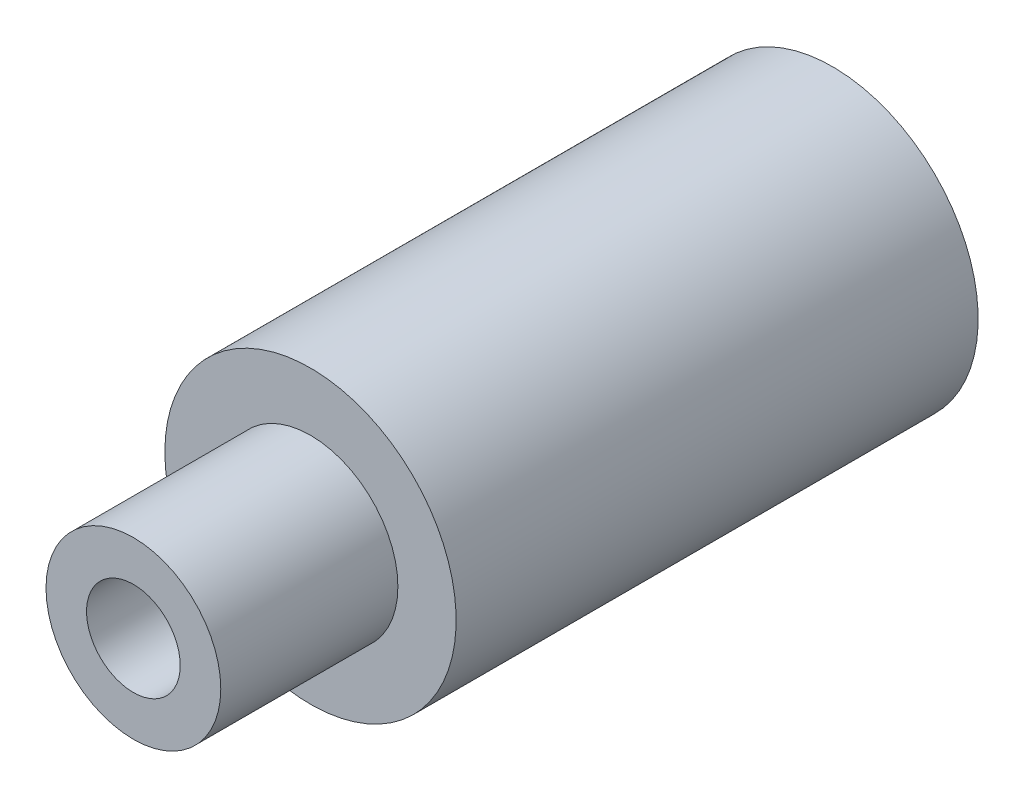
from build123d import *

# Parameters (mm, degrees)
SKETCH2_R                   = 7.9375
CYLINDER_BASE_DEPTH         = 38.1
TRIM_1_DEPTH                = 40.71923731
TRIM_1_DEPTH_BACK           = 9.652
SKETCH3_OUTSIDE_W           = 26.72
SKETCH3_OUTSIDE_H           = 26.72
SKETCH3_OUTSIDE_R           = 4.7625
F_1_4_20_TAPPED_HOLE1_D     = 5.1054
F_1_4_20_TAPPED_HOLE1_DEPTH = 17.516183098
F_1_4_20_TAPPED_HOLE1_TIP   = 1.533816902
F_1_4_20_TAPPED_HOLE9_D     = 5.1054
F_1_4_20_TAPPED_HOLE9_DEPTH = 12.436183098
F_1_4_20_TAPPED_HOLE9_TIP   = 1.533816902
SKETCH20_R                  = 2.5527
CUT_EXTRUDE2_DEPTH          = 40.71923731


with BuildPart() as part:
    # Sketch2 → Cylinder Base (new body)
    with BuildSketch(Plane.XY):
        with Locations(Location((0, 0, 0), (0, 0, 180))):
            Circle(SKETCH2_R)
    extrude(amount=CYLINDER_BASE_DEPTH)

    # Sketch3 outside → Trim 1 (cut, two sides: drawn at the far end of the back side and taken through both)
    with BuildSketch(Plane.XY.offset(38.1).offset(-TRIM_1_DEPTH_BACK)):
        Rectangle(SKETCH3_OUTSIDE_W, SKETCH3_OUTSIDE_H)
        with Locations(Location((0, 0, 0), (0, 0, 180))):
            Circle(SKETCH3_OUTSIDE_R, mode=Mode.SUBTRACT)
    extrude(amount=TRIM_1_DEPTH + TRIM_1_DEPTH_BACK, mode=Mode.SUBTRACT)

    # 1/4-20 Tapped Hole1
    with Locations(Plane.XY.offset(38.1)):
        with Locations((0, 0)):
            Hole(F_1_4_20_TAPPED_HOLE1_D / 2, depth=F_1_4_20_TAPPED_HOLE1_DEPTH)
            with Locations((0, 0, -(F_1_4_20_TAPPED_HOLE1_DEPTH + F_1_4_20_TAPPED_HOLE1_TIP / 2))):  # 118° drill point
                Cone(0, F_1_4_20_TAPPED_HOLE1_D / 2, F_1_4_20_TAPPED_HOLE1_TIP, mode=Mode.SUBTRACT)

    # 1/4-20 Tapped Hole9
    with Locations(Plane(origin=(0, 0, 0), x_dir=(-1, 0, 0), z_dir=(0, 0, -1))):
        with Locations((0, 0)):
            Hole(F_1_4_20_TAPPED_HOLE9_D / 2, depth=F_1_4_20_TAPPED_HOLE9_DEPTH)
            with Locations((0, 0, -(F_1_4_20_TAPPED_HOLE9_DEPTH + F_1_4_20_TAPPED_HOLE9_TIP / 2))):  # 118° drill point
                Cone(0, F_1_4_20_TAPPED_HOLE9_D / 2, F_1_4_20_TAPPED_HOLE9_TIP, mode=Mode.SUBTRACT)

    # Sketch20 → Cut-Extrude2 (cut, through all)
    with BuildSketch(Plane.XY.offset(38.1)):
        Circle(SKETCH20_R)
    extrude(amount=-CUT_EXTRUDE2_DEPTH, mode=Mode.SUBTRACT)


solid = part.part
